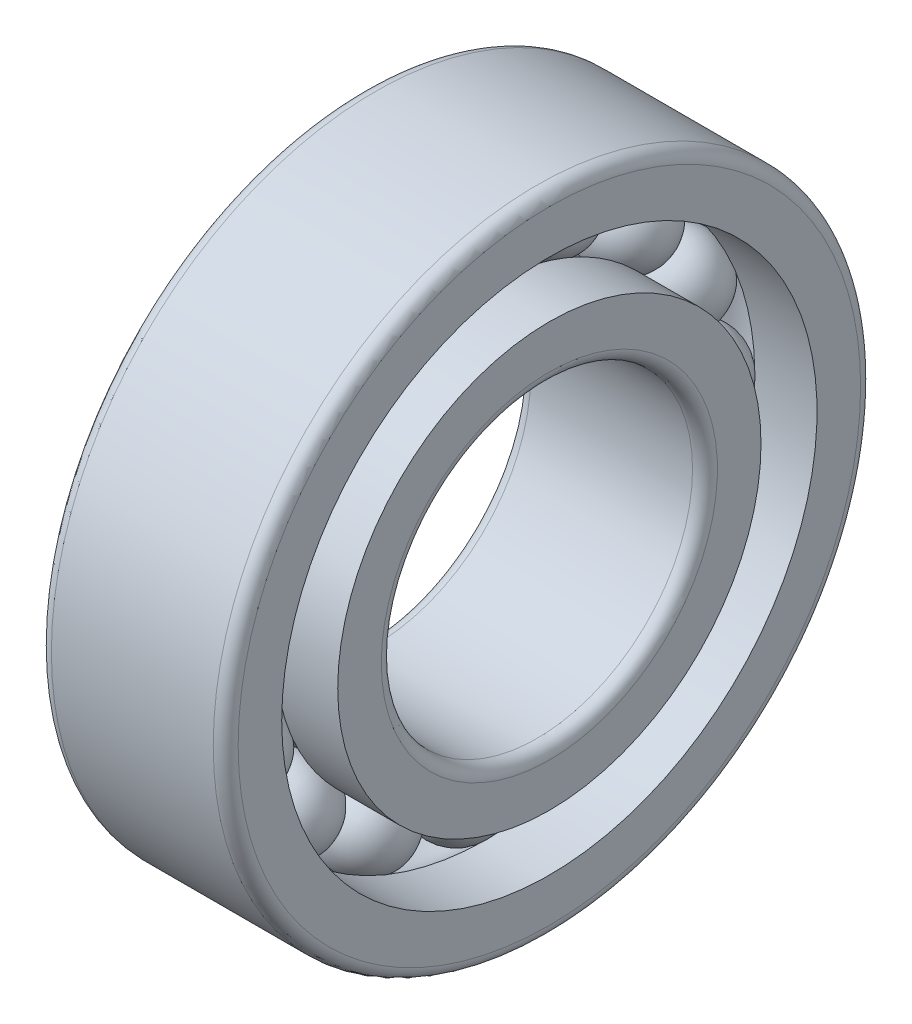
from build123d import *

# Parameters (mm, degrees)
CIRCULAR_PATTERN1_COUNT = 16
FILLET1_R               = 1
SCALE_1_SCALE           = 0.25


with BuildPart() as part:
    # Sketch1 → Revolve1 (revolve)
    with BuildSketch(Plane.XY):
        with BuildLine():
            Line((-3.375, 19.25), (3.375, 19.25))
            ThreePointArc((3.375, 19.25), (0, 22.625), (-3.375, 19.25))
        make_face()
    revolve1 = revolve(axis=Axis((-4.596601835, 19.25, 0), (1, 0, 0)))

    # Sketch2 → Revolve2 (revolve)
    with BuildSketch(Plane.XY, mode=Mode.PRIVATE) as revolve2_sk:
        with BuildLine():
            Line((-7.5, 17), (-7.5, 12.5))
            Line((-7.5, 12.5), (7.5, 12.5))
            Line((7.5, 12.5), (7.5, 17))
            Line((7.5, 17), (2.502144081, 17))
            ThreePointArc((2.502144081, 17), (0, 15.885), (-2.502144081, 17))
            Line((-2.502144081, 17), (-7.5, 17))
        make_face()
    revolve(revolve2_sk.sketch.rotate(Axis((-6.971390126, 0, 0), (1, 0, 0)), 90), axis=Axis((-6.971390126, 0, 0), (1, 0, 0)))

    # Sketch3 → Revolve3 (revolve)
    with BuildSketch(Plane.XY, mode=Mode.PRIVATE) as revolve3_sk:
        with BuildLine():
            Line((-7.5, 26), (7.5, 26))
            Line((7.5, 26), (7.5, 21.5))
            Line((7.5, 21.5), (2.502144081, 21.5))
            ThreePointArc((2.502144081, 21.5), (0, 22.615), (-2.502144081, 21.5))
            Line((-2.502144081, 21.5), (-7.5, 21.5))
            Line((-7.5, 21.5), (-7.5, 26))
        make_face()
    revolve(revolve3_sk.sketch.rotate(Axis((-8.710676495, 0, 0), (1, 0, 0)), 90), axis=Axis((-8.710676495, 0, 0), (1, 0, 0)))

    # Circular-Pattern1: Revolve1 ×16 about axis
    circular_pattern1_axis = Axis((0, 0, 0), (1, 0, 0))
    for i in range(1, CIRCULAR_PATTERN1_COUNT):
        add(revolve1.rotate(circular_pattern1_axis, i * 360 / CIRCULAR_PATTERN1_COUNT))

    # Fillet1
    fillet1_edges = [part.edges().sort_by_distance(p)[0] for p in [
        (-7.5, 0, -26),
        (7.5, 0, -26),
        (-7.5, 0, -12.5),
        (7.5, 0, -12.5),
    ]]
    fillet(fillet1_edges, radius=FILLET1_R)


with BuildPart() as part_1:
    # 缩放比例1: scaled about (0, 0, 0)
    add(part.part.scale(SCALE_1_SCALE))


solid = part_1.part
